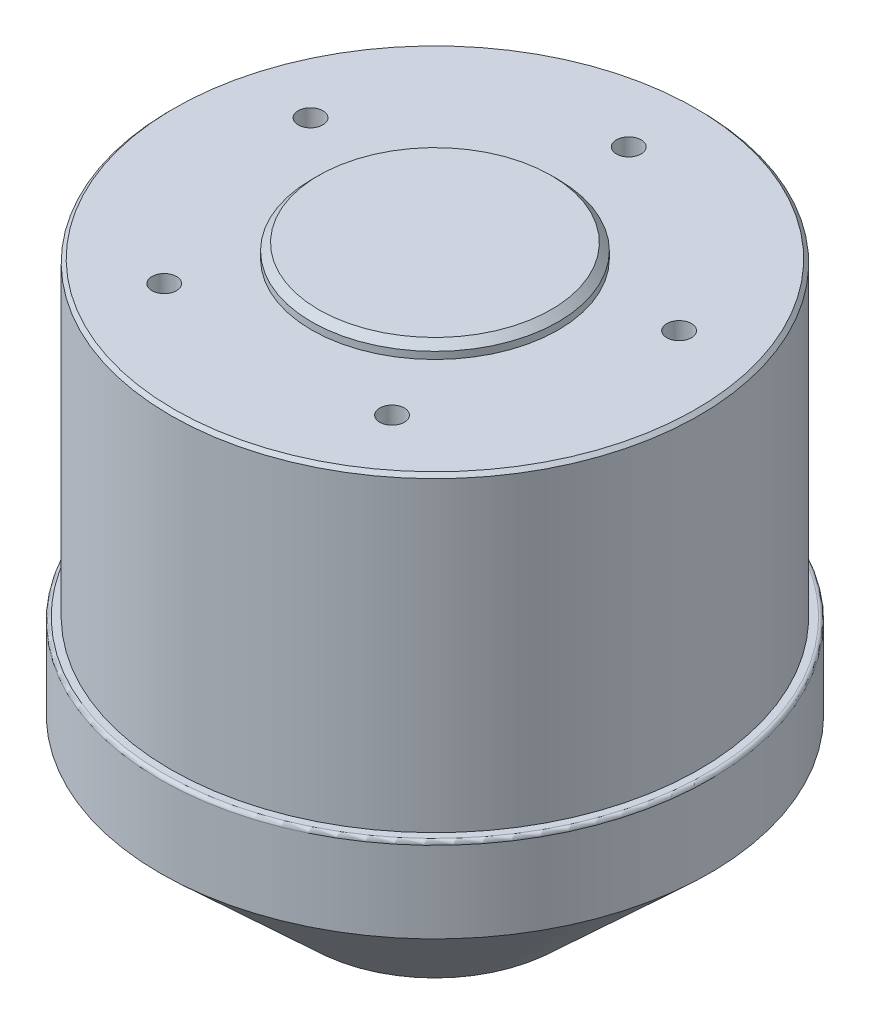
from build123d import *

# Parameters (mm, degrees)
SKETCH1_R           = 37.5
SKETCH1_R_2         = 17.5
BOSS_EXTRUDE1_DEPTH = 76
SKETCH1_3_R         = 17.5
BOSS_EXTRUDE2_DEPTH = 78
SKETCH1_4_R         = 39
SKETCH1_4_R_2       = 37.5
BOSS_EXTRUDE3_DEPTH = 32
SKETCH2_R           = 1.75
CUT_EXTRUDE1_DEPTH  = 7
FILLET1_R           = 0.5
CHAMFER1_SIZE       = 0.5
CHAMFER2_SIZE       = 21.5
CHAMFER2_SIZE2      = 20
CHAMFER3_SIZE       = 1


with BuildPart() as part:
    # Sketch1 → Boss-Extrude1 (new body)
    with BuildSketch(Plane(origin=(0, 0, 0), x_dir=(1, 0, 0), z_dir=(0, 1, 0))):
        Circle(SKETCH1_R)
        Circle(SKETCH1_R_2, mode=Mode.SUBTRACT)
    extrude(amount=BOSS_EXTRUDE1_DEPTH)

    # Sketch1<3> → Boss-Extrude2 (add)
    with BuildSketch(Plane(origin=(0, 0, 0), x_dir=(1, 0, 0), z_dir=(0, 1, 0))):
        Circle(SKETCH1_3_R)
    extrude(amount=BOSS_EXTRUDE2_DEPTH)

    # Sketch1<4> → Boss-Extrude3 (add)
    with BuildSketch(Plane(origin=(0, 0, 0), x_dir=(1, 0, 0), z_dir=(0, 1, 0))):
        Circle(SKETCH1_4_R)
        Circle(SKETCH1_4_R_2, mode=Mode.SUBTRACT)
    extrude(amount=BOSS_EXTRUDE3_DEPTH)

    # Sketch2 → Cut-Extrude1 (cut)
    with BuildSketch(Plane(origin=(0, 76, 0), x_dir=(1, 0, 0), z_dir=(0, 1, 0))):
        with Locations((0, 27.5)):
            Circle(SKETCH2_R)
        with Locations((26.154054198, 8.497967345)):
            Circle(SKETCH2_R)
        with Locations((16.164094438, -22.247967345)):
            Circle(SKETCH2_R)
        with Locations((-16.164094438, -22.247967345)):
            Circle(SKETCH2_R)
        with Locations((-26.154054198, 8.497967345)):
            Circle(SKETCH2_R)
    extrude(amount=-CUT_EXTRUDE1_DEPTH, mode=Mode.SUBTRACT)

    # Fillet1
    fillet1_edges = [part.edges().sort_by_distance(p)[0] for p in [
        (-39, 32, 0),
    ]]
    fillet(fillet1_edges, radius=FILLET1_R)

    # Chamfer1
    chamfer1_edges = [part.edges().sort_by_distance(p)[0] for p in [
        (-37.5, 76, 0),
    ]]
    chamfer(chamfer1_edges, length=CHAMFER1_SIZE)

    # Chamfer2
    chamfer2_edges = [part.edges().sort_by_distance(p)[0] for p in [
        (-39, 0, 0),
    ]]
    chamfer2_side = [part.faces().sort_by_distance(p)[0] for p in [
        (0, 0, 0),
    ]]
    chamfer(chamfer2_edges, length=CHAMFER2_SIZE, length2=CHAMFER2_SIZE2, reference=chamfer2_side[0])

    # Chamfer3
    chamfer3_edges = [part.edges().sort_by_distance(p)[0] for p in [
        (-17.5, 78, 0),
    ]]
    chamfer(chamfer3_edges, length=CHAMFER3_SIZE)


solid = part.part
